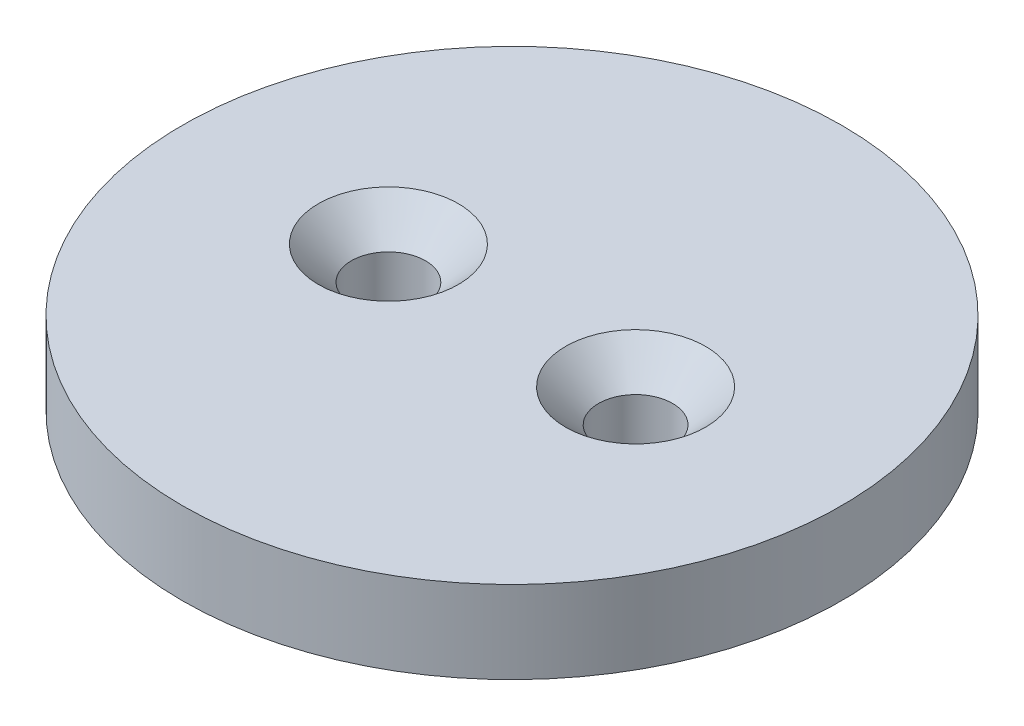
from build123d import *

# Parameters (mm, degrees)
SKETCH1_R           = 20
BOSS_EXTRUDE1_DEPTH = 5
SKETCH2_R           = 2.25
CUT_EXTRUDE1_DEPTH  = 5
CHAMFER1_SIZE       = 2


with BuildPart() as part:
    # Sketch1 → Boss-Extrude1 (new body)
    with BuildSketch(Plane(origin=(0, 0, 0), x_dir=(1, 0, 0), z_dir=(0, 1, 0))):
        with Locations(Location((0, 0, 0), (0, 0, 270))):
            Circle(SKETCH1_R)
    extrude(amount=BOSS_EXTRUDE1_DEPTH)

    # Sketch2 → Cut-Extrude1 (cut)
    with BuildSketch(Plane(origin=(0, 5, 0), x_dir=(1, 0, 0), z_dir=(0, 1, 0))):
        with Locations(Location((-7.5, 0, 0), (0, 0, 270))):
            Circle(SKETCH2_R)
        with Locations(Location((7.5, 0, 0), (0, 0, 270))):
            Circle(SKETCH2_R)
    extrude(amount=-CUT_EXTRUDE1_DEPTH, mode=Mode.SUBTRACT)

    # Chamfer1
    chamfer1_edges = [part.edges().sort_by_distance(p)[0] for p in [
        (7.5, 5, -2.25),
        (-7.5, 5, -2.25),
    ]]
    chamfer(chamfer1_edges, length=CHAMFER1_SIZE)


solid = part.part
